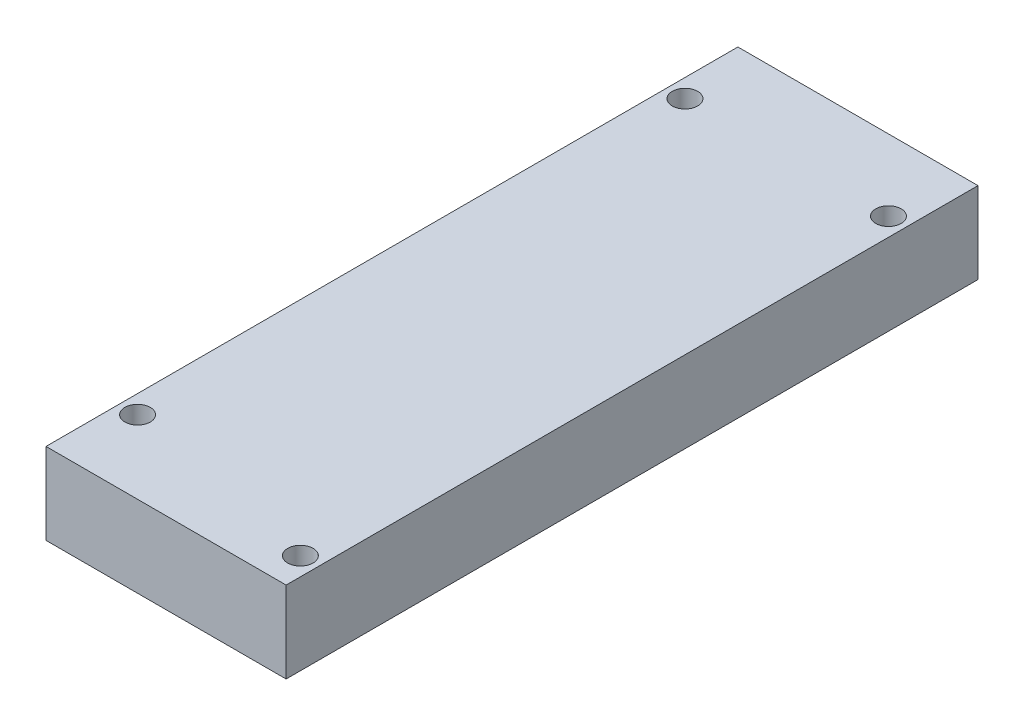
from build123d import *

# Parameters (mm, degrees)
SKETCH1_W           = 29.972
SKETCH1_H           = 10.16
BOSS_EXTRUDE1_DEPTH = 86.36
SKETCH2_R           = 1.5875
CUT_EXTRUDE1_DEPTH  = 12.7


with BuildPart() as part:
    # Sketch1 → Boss-Extrude1 (new body)
    with BuildSketch(Plane.XY):
        with Locations((2.823785016, -3.39218241)):
            Rectangle(SKETCH1_W, SKETCH1_H)
    extrude(amount=BOSS_EXTRUDE1_DEPTH)

    # Sketch2 → Cut-Extrude1 (cut)
    with BuildSketch(Plane(origin=(0, 1.68781759, 0), x_dir=(1, 0, 0), z_dir=(0, 1, 0))):
        with Locations((-9.876214984, -8.89)):
            Circle(SKETCH2_R)
        with Locations((15.523785016, -8.89)):
            Circle(SKETCH2_R)
        with Locations((-9.876214984, -77.216)):
            Circle(SKETCH2_R)
        with Locations((15.523785016, -82.296)):
            Circle(SKETCH2_R)
    extrude(amount=-CUT_EXTRUDE1_DEPTH, mode=Mode.SUBTRACT)


solid = part.part
